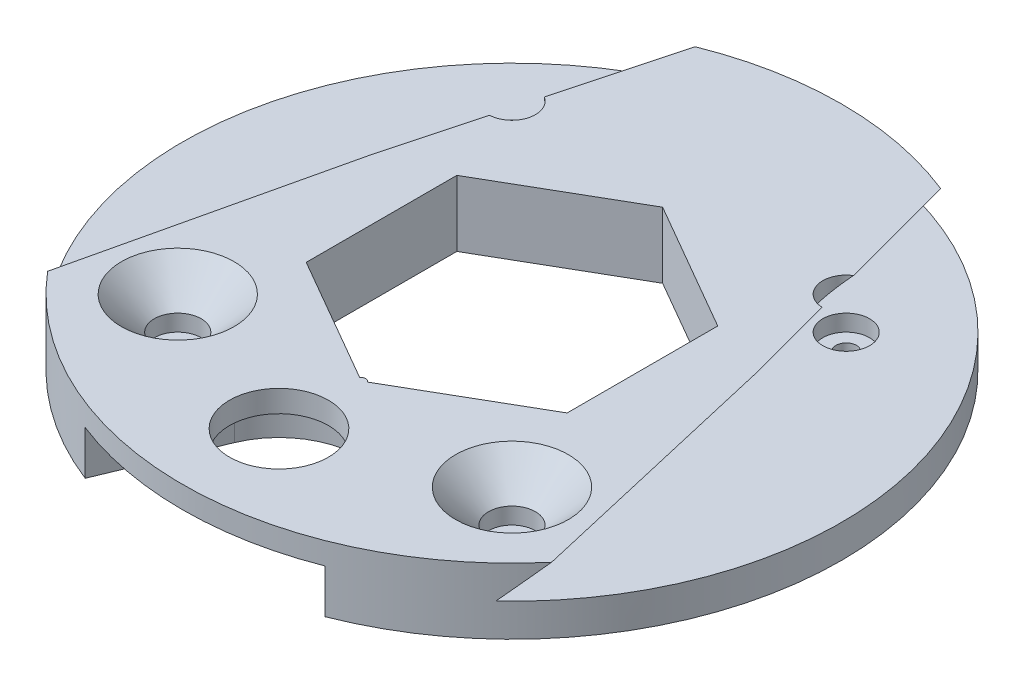
from build123d import *

# Parameters (mm, degrees)
SKETCH1_R               = 50
BOSS_EXTRUDE1_DEPTH     = 5
BOSS_EXTRUDE3_START     = 5
BOSS_EXTRUDE3_DEPTH     = 5
DRAFT2_ANGLE            = -45
CUT_EXTRUDE3_DEPTH      = 72.414284285
CUT_EXTRUDE3_DEPTH_BACK = 72.414284285
SKETCH3_R               = 7.5
CUT_EXTRUDE5_START      = -6.666666667
CUT_EXTRUDE5_DEPTH      = 6.666666667
SKETCH5_R               = 3.55
SKETCH5_R_2             = 1.55
CUT_EXTRUDE6_DEPTH      = 72.414284285
SKETCH5_3_R             = 3.55
SKETCH5_3_R_2           = 1.55
BOSS_EXTRUDE4_DEPTH     = 2.5
CUT_EXTRUDE8_DEPTH      = 72.414284285
CHAMFER1_SIZE           = 5


with BuildPart() as part:
    # Sketch1 → Boss-Extrude1 (new body)
    with BuildSketch(Plane(origin=(0, 0, 0), x_dir=(1, 0, 0), z_dir=(0, 1, 0))):
        with Locations(Location((0, 0, 0), (0, 0, 270))):
            Circle(SKETCH1_R)
    extrude(amount=-BOSS_EXTRUDE1_DEPTH)

    # Sketch1<6> → Boss-Extrude3 (add)
    with BuildSketch(Plane(origin=(0, 0, 0), x_dir=(1, 0, 0), z_dir=(0, 1, 0)).offset(BOSS_EXTRUDE3_START)):
        with BuildLine():
            Line((-24.148145658, 6.470476128), (-34.10533906, -36.562629112))
            ThreePointArc((-34.10533906, -36.562629112), (0, -50), (34.10533906, -36.562629112))
            Line((34.10533906, -36.562629112), (24.148145658, 6.470476128))
            Line((24.148145658, 6.470476128), (12.940952256, 48.296291314))
            ThreePointArc((12.940952256, 48.296291314), (0, 50), (-12.940952256, 48.296291314))
            Line((-12.940952256, 48.296291314), (-24.148145658, 6.470476128))
        make_face()
    extrude(amount=-BOSS_EXTRUDE3_DEPTH)

    # Draft2
    draft2_faces = [part.faces().sort_by_distance(p)[0] for p in [
        (-29.126742359, 2.5, 15.046076492),
        (-18.544548957, 2.5, -27.383383721),
        (18.544548957, 2.5, -27.383383721),
        (29.126742359, 2.5, 15.046076492),
    ]]
    draft(draft2_faces, Plane.ZX, DRAFT2_ANGLE)

    # Sketch3 → Cut-Extrude3 (cut, two sides: drawn at the far end of the back side and taken through both)
    with BuildSketch(Plane.XZ.offset(5).offset(-CUT_EXTRUDE3_DEPTH_BACK)):
        with Locations(Location((0, 35.355339059, 0), (0, 0, 270))):
            Circle(SKETCH3_R)
    extrude(amount=CUT_EXTRUDE3_DEPTH + CUT_EXTRUDE3_DEPTH_BACK, mode=Mode.SUBTRACT)

    # Sketch4 → Cut-Extrude5 (cut)
    with BuildSketch(Plane.XZ.offset(5).offset(CUT_EXTRUDE5_START)):
        with BuildLine():
            ThreePointArc((18.178606224, 46.578302628), (0, 50), (-18.178606224, 46.578302628))
            Line((-18.178606224, 46.578302628), (-11.548494202, 30.571796264))
            ThreePointArc((-11.548494202, 30.571796264), (3.3e-08, 22.855339059), (11.548494227, 30.571796326))
            Line((11.548494227, 30.571796326), (18.178606224, 46.578302628))
        make_face()
    extrude(amount=CUT_EXTRUDE5_DEPTH, mode=Mode.SUBTRACT)

    # Sketch5 → Cut-Extrude6 (cut, through all)
    # profile 1 of 8: a face of its own
    with BuildSketch(Plane.XZ.offset(5)):
        with Locations(Location((25.355339059, 25.355339059, 0), (0, 0, 270))):
            Circle(SKETCH5_R)
        with Locations((25.355339059, 25.355339059)):
            Circle(SKETCH5_R_2, mode=Mode.SUBTRACT)
    # profile 2 of 8: a face of its own
    with BuildSketch(Plane.XZ.offset(5)):
        with Locations((25.355339059, 25.355339059)):
            Circle(SKETCH5_R_2)
    # profile 3 of 8: a face of its own
    with BuildSketch(Plane.XZ.offset(5)):
        with Locations(Location((25.355339059, -25.355339059, 0), (0, 0, 270))):
            Circle(SKETCH5_R)
        with Locations((25.355339059, -25.355339059)):
            Circle(SKETCH5_R_2, mode=Mode.SUBTRACT)
    # profile 4 of 8: a face of its own
    with BuildSketch(Plane.XZ.offset(5)):
        with Locations((25.355339059, -25.355339059)):
            Circle(SKETCH5_R_2)
    # profile 5 of 8: a face of its own
    with BuildSketch(Plane.XZ.offset(5)):
        with Locations(Location((-25.355339059, -25.355339059, 0), (0, 0, 270))):
            Circle(SKETCH5_R)
        with Locations((-25.355339059, -25.355339059)):
            Circle(SKETCH5_R_2, mode=Mode.SUBTRACT)
    # profile 6 of 8: a face of its own
    with BuildSketch(Plane.XZ.offset(5)):
        with Locations((-25.355339059, -25.355339059)):
            Circle(SKETCH5_R_2)
    # profile 7 of 8: a face of its own
    with BuildSketch(Plane.XZ.offset(5)):
        with Locations(Location((-25.355339059, 25.355339059, 0), (0, 0, 270))):
            Circle(SKETCH5_R)
        with Locations((-25.355339059, 25.355339059)):
            Circle(SKETCH5_R_2, mode=Mode.SUBTRACT)
    # profile 8 of 8: a face of its own
    with BuildSketch(Plane.XZ.offset(5)):
        with Locations((-25.355339059, 25.355339059)):
            Circle(SKETCH5_R_2)
    extrude(amount=-CUT_EXTRUDE6_DEPTH, mode=Mode.SUBTRACT)

    # Sketch5<3> → Boss-Extrude4 (add)
    # profile 1 of 4: a face of its own
    with BuildSketch(Plane.XZ.offset(5)):
        with Locations(Location((25.355339059, -25.355339059, 0), (0, 0, 270))):
            Circle(SKETCH5_3_R)
        with Locations(Location((25.355339059, -25.355339059, 0), (0, 0, 270))):
            Circle(SKETCH5_3_R_2, mode=Mode.SUBTRACT)
    # profile 2 of 4: a face of its own
    with BuildSketch(Plane.XZ.offset(5)):
        with Locations(Location((-25.355339059, -25.355339059, 0), (0, 0, 270))):
            Circle(SKETCH5_3_R)
        with Locations(Location((-25.355339059, -25.355339059, 0), (0, 0, 270))):
            Circle(SKETCH5_3_R_2, mode=Mode.SUBTRACT)
    # profile 3 of 4: a face of its own
    with BuildSketch(Plane.XZ.offset(5)):
        with Locations(Location((25.355339059, 25.355339059, 0), (0, 0, 270))):
            Circle(SKETCH5_3_R)
        with Locations(Location((25.355339059, 25.355339059, 0), (0, 0, 270))):
            Circle(SKETCH5_3_R_2, mode=Mode.SUBTRACT)
    # profile 4 of 4: a face of its own
    with BuildSketch(Plane.XZ.offset(5)):
        with Locations(Location((-25.355339059, 25.355339059, 0), (0, 0, 270))):
            Circle(SKETCH5_3_R)
        with Locations(Location((-25.355339059, 25.355339059, 0), (0, 0, 270))):
            Circle(SKETCH5_3_R_2, mode=Mode.SUBTRACT)
    extrude(amount=-BOSS_EXTRUDE4_DEPTH)

    # Sketch6 → Cut-Extrude8 (cut, through all)
    with BuildSketch(Plane(origin=(0, 5, 0), x_dir=(1, 0, 0), z_dir=(0, 1, 0))):
        with BuildLine():
            ThreePointArc((-0.574925376, -22.523405739), (0, -22.191472419), (0.574925376, -22.523405739))
            Line((0.574925376, -22.523405739), (19.793304237, -11.42766953))
            Line((19.793304237, -11.42766953), (19.793304237, 11.42766953))
            Line((19.793304237, 11.42766953), (0, 22.855339059))
            Line((0, 22.855339059), (-19.793304237, 11.42766953))
            Line((-19.793304237, 11.42766953), (-19.793304237, -11.42766953))
            Line((-19.793304237, -11.42766953), (-0.574925376, -22.523405739))
        make_face()
    extrude(amount=-CUT_EXTRUDE8_DEPTH, mode=Mode.SUBTRACT)

    # Chamfer1
    chamfer1_edges = [part.edges().sort_by_distance(p)[0] for p in [
        (-25.355339059, 5, 28.905339059),
        (25.355339059, 5, 28.905339059),
    ]]
    chamfer(chamfer1_edges, length=CHAMFER1_SIZE)


solid = part.part
